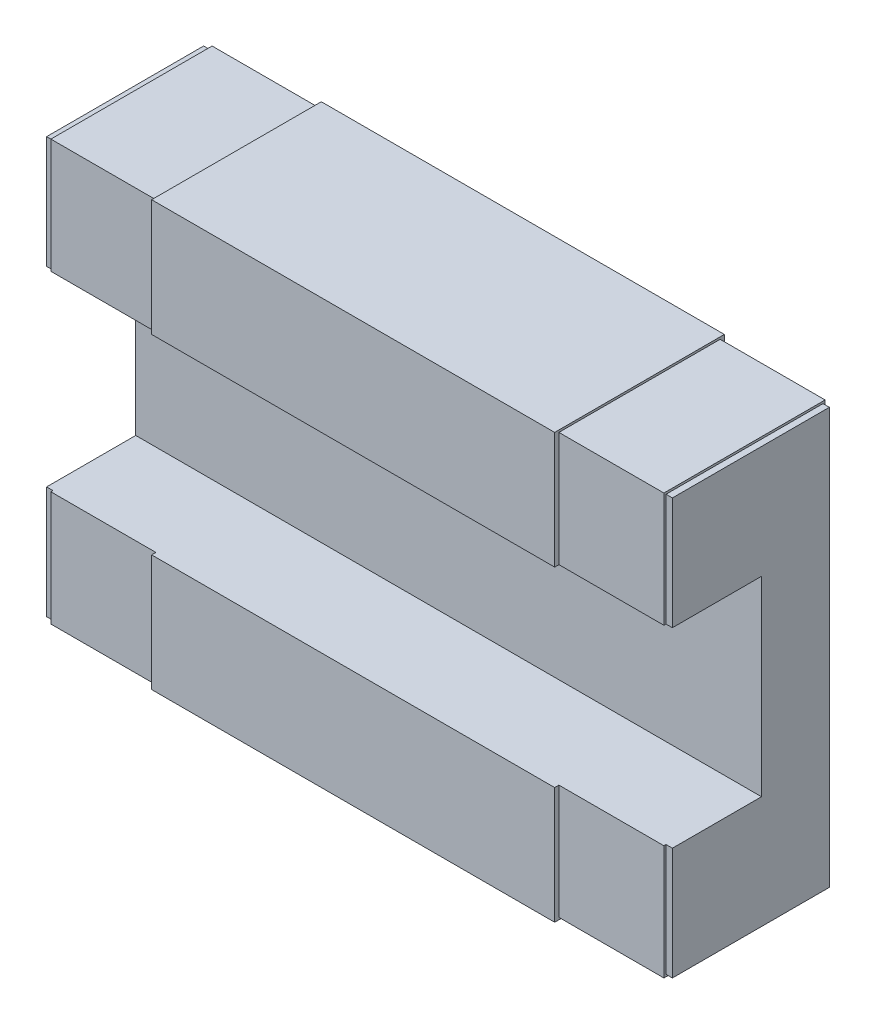
from build123d import *

# Parameters (mm, degrees)
ESQUISSE1_W                                   = 29.5
ESQUISSE1_H                                   = 20
BOSS_EXTRU_1_DEPTH                            = 4
ENL_V_MAT_EXTRU_1_DEPTH                       = 32.404617495
ENL_V_MAT_EXTRU_1_DEPTH_BACK                  = 32.404617495
ESQUISSE2_W                                   = 4.5
ESQUISSE2_H                                   = 9
ESQUISSE3_W                                   = 19
ESQUISSE3_H                                   = 10
ENL_V_MAT_EXTRU_2_DEPTH                       = 0.1
ESQUISSE4_W                                   = 5.25
ESQUISSE4_H                                   = 20
ENL_V_MAT_EXTRU_3_DEPTH                       = 0.2
ESQUISSE5_W                                   = 0.3
ESQUISSE5_H                                   = 20
ENL_V_MAT_EXTRU_4_DEPTH                       = 0.1
ESQUISSE6_W                                   = 5.25
ESQUISSE6_H                                   = 7.8
ENL_V_MAT_EXTRU_5_DEPTH                       = 0.1
ESQUISSE7_W                                   = 0.3
ESQUISSE7_H                                   = 7.8
ENL_V_MAT_EXTRU_6_DEPTH                       = 0.1
TROU_POUR_TARAUDAGE_POUR_TROU_TARAUD_M3_D     = 2.5
TROU_POUR_TARAUDAGE_POUR_TROU_TARAUD_M3_DEPTH = 4
TROU_POUR_TARAUDAGE_POUR_TROU_TARAUD_M3_TIP   = 0.751075774


with BuildPart() as part:
    # Esquisse1 → Boss.-Extru.1 (new, symmetric)
    with BuildSketch(Plane.XY):
        Rectangle(ESQUISSE1_W, ESQUISSE1_H)
    extrude(amount=BOSS_EXTRU_1_DEPTH, both=True)

    # Esquisse2 → Enlèv. mat.-Extru.1 (cut, two sides: drawn at the far end of the back side and taken through both)
    with BuildSketch(Plane(origin=(14.75, 0, 0), x_dir=(0, 0, -1), z_dir=(1, 0, 0)).offset(-ENL_V_MAT_EXTRU_1_DEPTH_BACK)):
        with Locations((-1.75, 0)):
            Rectangle(ESQUISSE2_W, ESQUISSE2_H)
    extrude(amount=ENL_V_MAT_EXTRU_1_DEPTH + ENL_V_MAT_EXTRU_1_DEPTH_BACK, mode=Mode.SUBTRACT)

    # Esquisse3 → Enlèv. mat.-Extru.2 (cut)
    with BuildSketch(Plane(origin=(0, 0, -4), x_dir=(-1, 0, 0), z_dir=(0, 0, -1))):
        Rectangle(ESQUISSE3_W, ESQUISSE3_H)
    extrude(amount=-ENL_V_MAT_EXTRU_2_DEPTH, mode=Mode.SUBTRACT)

    # Esquisse4 → Enlèv. mat.-Extru.3 (cut)
    with BuildSketch(Plane(origin=(0, 0, -4), x_dir=(-1, 0, 0), z_dir=(0, 0, -1))):
        with Locations((-12.125, 0)):
            Rectangle(ESQUISSE4_W, ESQUISSE4_H)
        with Locations((12.125, 0)):
            Rectangle(ESQUISSE4_W, ESQUISSE4_H)
    enl_v_mat_extru_3 = extrude(amount=-ENL_V_MAT_EXTRU_3_DEPTH, mode=Mode.SUBTRACT)

    # Esquisse5 → Enlèv. mat.-Extru.4 (cut)
    with BuildSketch(Plane(origin=(0, 0, -3.8), x_dir=(-1, 0, 0), z_dir=(0, 0, -1))):
        with Locations((-14.6, 0)):
            Rectangle(ESQUISSE5_W, ESQUISSE5_H)
        with Locations((14.6, 0)):
            Rectangle(ESQUISSE5_W, ESQUISSE5_H)
    enl_v_mat_extru_4 = extrude(amount=-ENL_V_MAT_EXTRU_4_DEPTH, mode=Mode.SUBTRACT)

    # Esquisse6 → Enlèv. mat.-Extru.5 (cut)
    with BuildSketch(Plane.XZ.offset(10)):
        with Locations((12.125, 0.1)):
            Rectangle(ESQUISSE6_W, ESQUISSE6_H)
        with Locations((-12.125, 0.1)):
            Rectangle(ESQUISSE6_W, ESQUISSE6_H)
    enl_v_mat_extru_5 = extrude(amount=-ENL_V_MAT_EXTRU_5_DEPTH, mode=Mode.SUBTRACT)

    # Esquisse7 → Enlèv. mat.-Extru.6 (cut)
    with BuildSketch(Plane.XZ.offset(9.9)):
        with Locations((-14.6, 0.1)):
            Rectangle(ESQUISSE7_W, ESQUISSE7_H)
        with Locations((14.6, 0.1)):
            Rectangle(ESQUISSE7_W, ESQUISSE7_H)
    enl_v_mat_extru_6 = extrude(amount=-ENL_V_MAT_EXTRU_6_DEPTH, mode=Mode.SUBTRACT)

    # Symétrie2: Enlèv. mat.-Extru.3, Enlèv. mat.-Extru.4 across plane
    add(enl_v_mat_extru_3.mirror(Plane.XY), mode=Mode.SUBTRACT)
    add(enl_v_mat_extru_4.mirror(Plane.XY), mode=Mode.SUBTRACT)

    # Symétrie2 at the second plane: Enlèv. mat.-Extru.3, Enlèv. mat.-Extru.4 across plane
    add(enl_v_mat_extru_3.mirror(Plane.ZX), mode=Mode.SUBTRACT)
    add(enl_v_mat_extru_4.mirror(Plane.ZX), mode=Mode.SUBTRACT)

    # Symétrie3: Enlèv. mat.-Extru.5, Enlèv. mat.-Extru.6 across plane
    add(enl_v_mat_extru_5.mirror(Plane.ZX), mode=Mode.SUBTRACT)
    add(enl_v_mat_extru_6.mirror(Plane.ZX), mode=Mode.SUBTRACT)

    # Trou pour taraudage pour trou taraudé M31
    with Locations(Plane(origin=(0, 0, -4), x_dir=(-1, 0, 0), z_dir=(0, 0, -1))):
        with Locations((-5, 7.5), (5, 7.5), (-5, -7.5), (5, -7.5)):
            Hole(TROU_POUR_TARAUDAGE_POUR_TROU_TARAUD_M3_D / 2, depth=TROU_POUR_TARAUDAGE_POUR_TROU_TARAUD_M3_DEPTH)
            with Locations((0, 0, -(TROU_POUR_TARAUDAGE_POUR_TROU_TARAUD_M3_DEPTH + TROU_POUR_TARAUDAGE_POUR_TROU_TARAUD_M3_TIP / 2))):  # 118° drill point
                Cone(0, TROU_POUR_TARAUDAGE_POUR_TROU_TARAUD_M3_D / 2, TROU_POUR_TARAUDAGE_POUR_TROU_TARAUD_M3_TIP, mode=Mode.SUBTRACT)


solid = part.part
